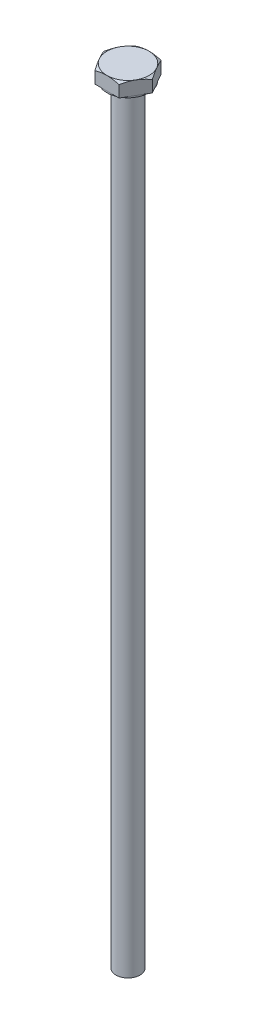
from build123d import *

# Parameters (mm, degrees)
BASE_EXTRUDE_DEPTH  = 3.96875
SKETCH5_R           = 3.175
BOSS_EXTRUDE1_DEPTH = 203.2
CHAMFER1_SIZE       = 0.635
CHAMFER1_SIZE2      = 0.366617421


with BuildPart() as part:
    # Sketch4 → Base-Extrude (new body)
    with BuildSketch(Plane(origin=(0, 0, 0), x_dir=(1, 0, 0), z_dir=(0, 1, 0))):
        Polygon((6.415804866, 0), (3.207902433, 5.55625), (-3.207902433, 5.55625), (-6.415804866, 0), (-3.207902433, -5.55625), (3.207902433, -5.55625), align=None)
    extrude(amount=BASE_EXTRUDE_DEPTH)

    # Sketch5 → Boss-Extrude1 (add)
    with BuildSketch(Plane.XZ):
        with Locations(Location((0, 0, 0), (0, 0, 90))):
            Circle(SKETCH5_R)
    extrude(amount=BOSS_EXTRUDE1_DEPTH)

    # Sketch8 → Cut-Revolve1 (revolve, cut)
    with BuildSketch(Plane(origin=(0, 0, 0), x_dir=(0, 0, -1), z_dir=(1, 0, 0)), mode=Mode.PRIVATE) as cut_revolve1_sk:
        Polygon((5.55625, 3.96875), (11.726421194, 0.4064), (5.55625, 0.4064), (5.55625, 0), (14.266421194, 0), (14.266421194, 3.96875), align=None)
    revolve(cut_revolve1_sk.sketch.rotate(Axis((0, 0, 0), (0, 1, 0)), 180), axis=Axis((0, 0, 0), (0, 1, 0)), mode=Mode.SUBTRACT)

    # Chamfer1
    chamfer1_edges = [part.edges().sort_by_distance(p)[0] for p in [
        (0, -203.2, -3.175),
    ]]
    chamfer1_side = [part.faces().sort_by_distance(p)[0] for p in [
        (0, -203.2, 0),
    ]]
    chamfer(chamfer1_edges, length=CHAMFER1_SIZE, length2=CHAMFER1_SIZE2, reference=chamfer1_side[0])


solid = part.part
